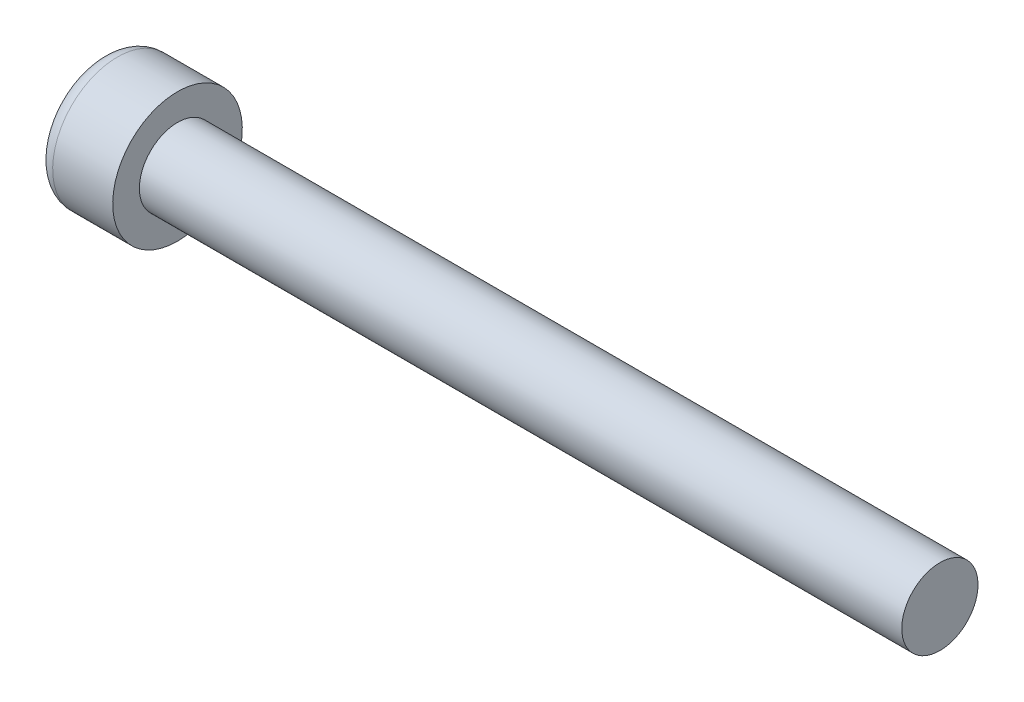
from build123d import *

# Parameters (mm, degrees)
CUT_EXTRUDE1_DEPTH = 2.5


with BuildPart() as part:
    # Sketch1 → Revolve1 (revolve)
    with BuildSketch(Plane.XY, mode=Mode.PRIVATE) as revolve1_sk:
        with BuildLine():
            Line((0, 0), (0, 3.1875))
            ThreePointArc((0, 3.1875), (0.311199045, 3.938800955), (1.0625, 4.25))
            Line((1.0625, 4.25), (5, 4.25))
            Line((5, 4.25), (5, 2.5))
            Line((5, 2.5), (55, 2.5))
            Line((55, 2.5), (55, 0))
            Line((55, 0), (0, 0))
        make_face()
    revolve(revolve1_sk.sketch.rotate(Axis((0, 0, 0), (1, 0, 0)), 180), axis=Axis((0, 0, 0), (1, 0, 0)))

    # Sketch2 → Cut-Extrude1 (cut)
    with BuildSketch(Plane.ZY):
        Polygon((0, 2.309401077), (-2, 1.154700538), (-2, -1.154700538), (0, -2.309401077), (2, -1.154700538), (2, 1.154700538), align=None)
    extrude(amount=-CUT_EXTRUDE1_DEPTH, mode=Mode.SUBTRACT)


solid = part.part
